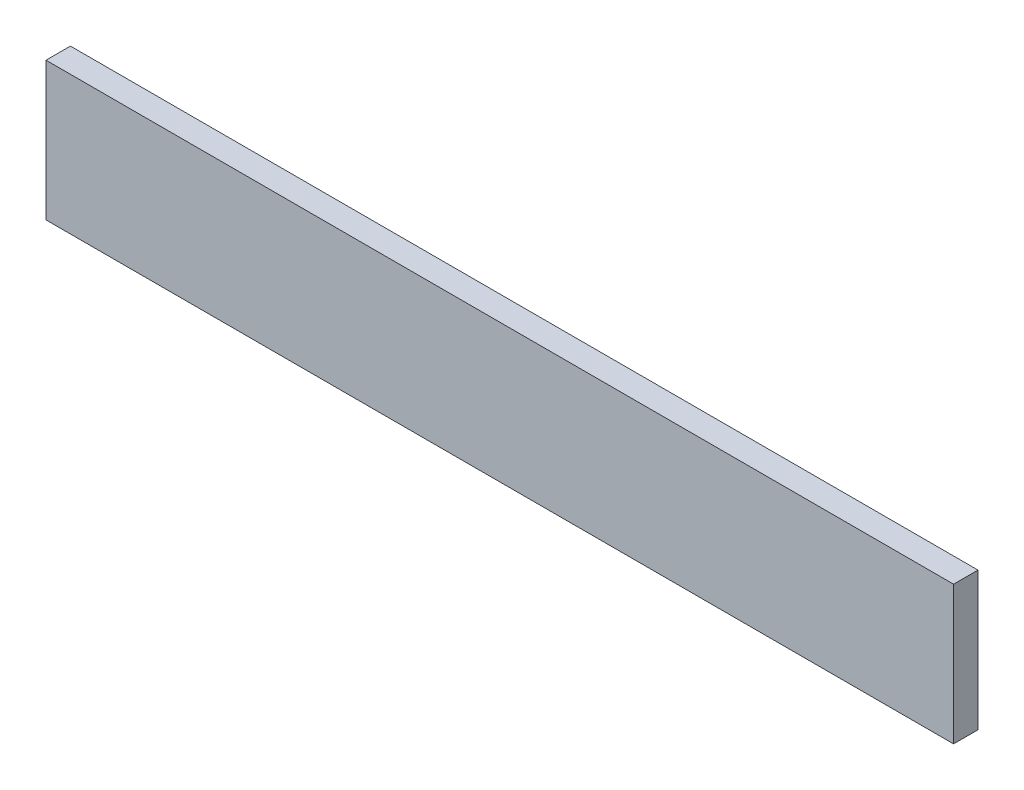
from build123d import *

# Parameters (mm, degrees)
SKIZZE1_W               = 37.1602
SKIZZE1_H               = 5.6642
COMPONENT_OUTLINE_DEPTH = 1


with BuildPart() as part:
    # Skizze1 → Component_Outline (new body)
    with BuildSketch(Plane.XY):
        with Locations((-0.0381, -0.0381)):
            Rectangle(SKIZZE1_W, SKIZZE1_H)
    extrude(amount=COMPONENT_OUTLINE_DEPTH)


solid = part.part
